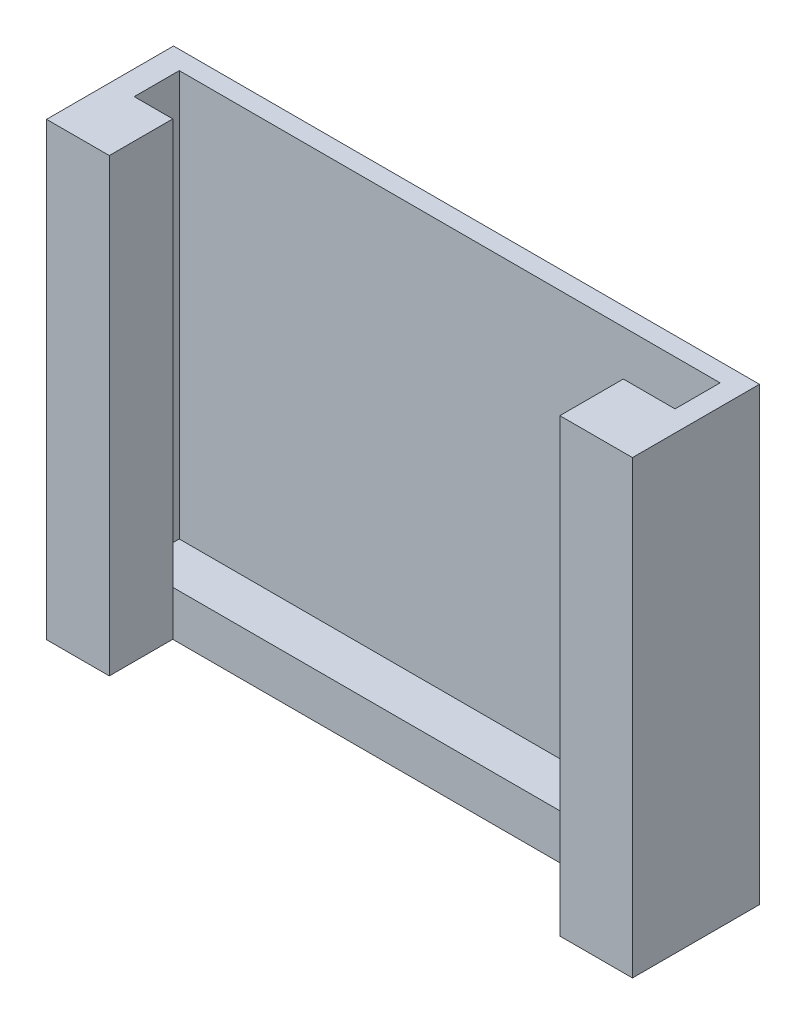
from build123d import *

# Parameters (mm, degrees)
SKETCH1_W           = 13
SKETCH1_H           = 28
BOSS_EXTRUDE1_DEPTH = 10
CUT_EXTRUDE1_DEPTH  = 9
CUT_EXTRUDE3_DEPTH  = 19.391574158


with BuildPart() as part:
    # Sketch1 → Boss-Extrude1 (new body)
    with BuildSketch(Plane(origin=(0, 0, 0), x_dir=(1, 0, 0), z_dir=(0, 1, 0))):
        Rectangle(SKETCH1_W, SKETCH1_H)
    extrude(amount=BOSS_EXTRUDE1_DEPTH)

    # Sketch2 → Cut-Extrude1 (cut)
    with BuildSketch(Plane(origin=(0, 10, 0), x_dir=(1, 0, 0), z_dir=(0, 1, 0))):
        Polygon((0, 13.590584793), (-5.963515209, 13.590584793), (-5.963515209, 12.590584793), (6.036484791, 12.590584793), (6.036484791, 13.590584793), align=None)
    extrude(amount=-CUT_EXTRUDE1_DEPTH, mode=Mode.SUBTRACT)

    # Sketch3 → Cut-Extrude3 (cut, through all)
    with BuildSketch(Plane(origin=(0, 10, 0), x_dir=(1, 0, 0), z_dir=(0, 1, 0))):
        Polygon((-5.107870795, 12.590584793), (-5.107870795, 11.182588561), (-6.5, 11.182588561), (-6.5, -14), (6.5, -14), (6.5, 11.182588561), (4.888962046, 11.182588561), (4.888962046, 12.590584793), align=None)
    extrude(amount=-CUT_EXTRUDE3_DEPTH, mode=Mode.SUBTRACT)


solid = part.part
